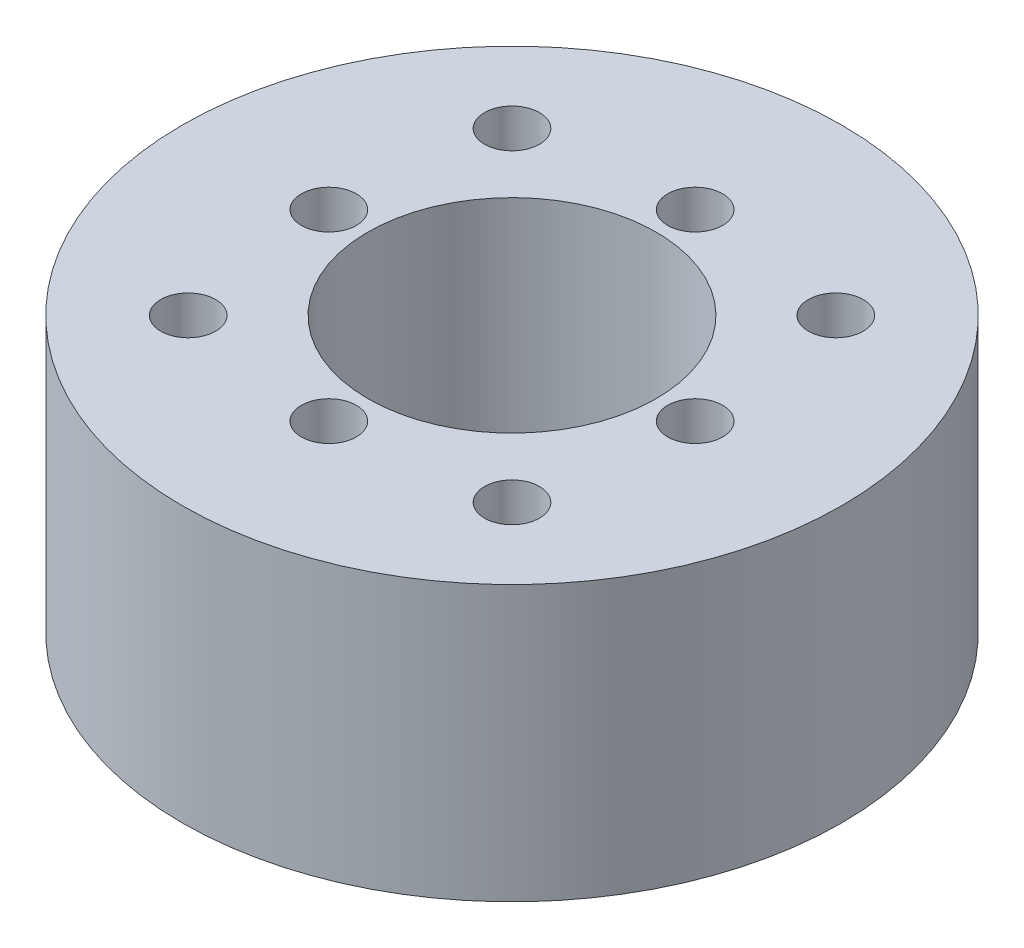
from build123d import *

# Parameters (mm, degrees)
SKETCH1_R           = 36
BOSS_EXTRUDE1_DEPTH = 30
SKETCH2_R           = 3
CUT_EXTRUDE1_DEPTH  = 30
SKETCH4_R           = 3
CUT_EXTRUDE2_DEPTH  = 30
SKETCH5_R           = 15.75
CUT_EXTRUDE3_DEPTH  = 30


with BuildPart() as part:
    # Sketch1 → Boss-Extrude1 (new body)
    with BuildSketch(Plane(origin=(0, 0, 0), x_dir=(1, 0, 0), z_dir=(0, 1, 0))):
        Circle(SKETCH1_R)
    extrude(amount=BOSS_EXTRUDE1_DEPTH)

    # Sketch2 → Cut-Extrude1 (cut)
    with BuildSketch(Plane(origin=(0, 30, 0), x_dir=(1, 0, 0), z_dir=(0, 1, 0))):
        with Locations((20, 0)):
            Circle(SKETCH2_R)
        with Locations((0, -20)):
            Circle(SKETCH2_R)
        with Locations((-20, 0)):
            Circle(SKETCH2_R)
        with Locations((0, 20)):
            Circle(SKETCH2_R)
    extrude(amount=-CUT_EXTRUDE1_DEPTH, mode=Mode.SUBTRACT)

    # Sketch4 → Cut-Extrude2 (cut)
    with BuildSketch(Plane(origin=(0, 30, 0), x_dir=(1, 0, 0), z_dir=(0, 1, 0))):
        with Locations((17.67766953, 17.67766953)):
            Circle(SKETCH4_R)
        with Locations((17.67766953, -17.67766953)):
            Circle(SKETCH4_R)
        with Locations((-17.67766953, -17.67766953)):
            Circle(SKETCH4_R)
        with Locations((-17.67766953, 17.67766953)):
            Circle(SKETCH4_R)
    extrude(amount=-CUT_EXTRUDE2_DEPTH, mode=Mode.SUBTRACT)

    # Sketch5 → Cut-Extrude3 (cut)
    with BuildSketch(Plane(origin=(0, 30, 0), x_dir=(1, 0, 0), z_dir=(0, 1, 0))):
        Circle(SKETCH5_R)
    extrude(amount=-CUT_EXTRUDE3_DEPTH, mode=Mode.SUBTRACT)


solid = part.part
